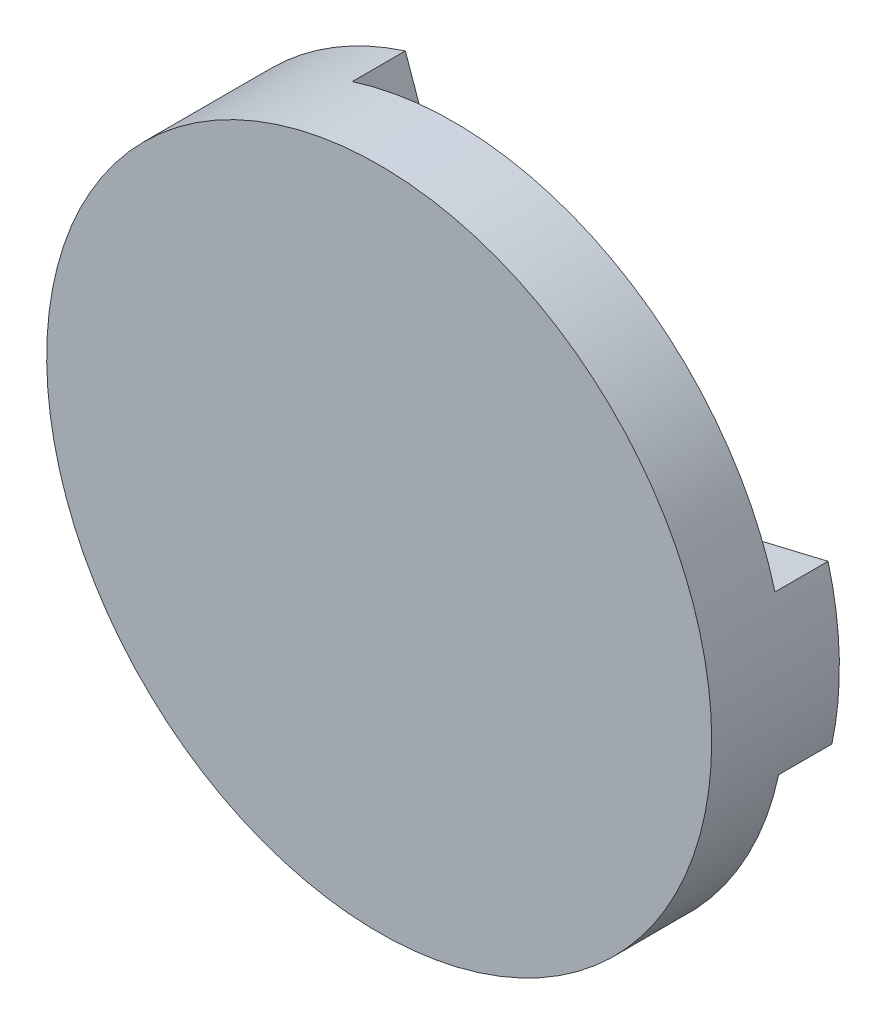
from build123d import *

# Parameters (mm, degrees)
BOSS_EXTRUDE1_DEPTH   = 12.7
BOSS_EXTRUDE1_2_DEPTH = 12.7
BOSS_EXTRUDE1_3_DEPTH = 12.7
SKETCH3_R             = 35.68082971
BOSS_EXTRUDE2_DEPTH   = 1
CUT_EXTRUDE1_DEPTH    = 3
BOSS_EXTRUDE3_START   = 7
BOSS_EXTRUDE3_DEPTH   = 7


with BuildPart() as part:
    # Sketch2 → Boss-Extrude1 (new body)
    with BuildSketch(Plane.XY):
        with BuildLine():
            Line((-39.100035207, -47.596183278), (-14.633983159, -52.182948751))
            ThreePointArc((-14.633983159, -52.182948751), (-13.835344136, -43.767548454), (-15.038788838, -35.400439796))
            Line((-15.038788838, -35.400439796), (-39.255245143, -41.161460912))
            ThreePointArc((-39.255245143, -41.161460912), (-38.688115422, -44.36701442), (-39.100035207, -47.596183278))
        make_face()
    extrude(amount=BOSS_EXTRUDE1_DEPTH)



with BuildPart() as body_2:
    # Sketch2 → Boss-Extrude1 2 (new body)
    with BuildSketch(Plane.XY):
        with BuildLine():
            Line((-52.138110144, -34.132169435), (-60.398880747, -10.650564096))
            ThreePointArc((-60.398880747, -10.650564096), (-68.086150698, -14.166622561), (-74.730557001, -19.392390574))
            Line((-74.730557001, -19.392390574), (-57.633138211, -37.483946366))
            ThreePointArc((-57.633138211, -37.483946366), (-55.1406123, -35.390020866), (-52.138110144, -34.132169435))
        make_face()
    extrude(amount=BOSS_EXTRUDE1_2_DEPTH)


with BuildPart() as body_3:
    # Sketch2 → Boss-Extrude1 3 (new body)
    with BuildSketch(Plane.XY):
        with BuildLine():
            Line((-58.748050211, -79.091002811), (-51.629012696, -55.238425903))
            ThreePointArc((-51.629012696, -55.238425903), (-54.688668329, -54.126797895), (-57.2792507, -52.155480469))
            Line((-57.2792507, -52.155480469), (-73.484532144, -71.050320335))
            ThreePointArc((-73.484532144, -71.050320335), (-66.595901216, -75.949662166), (-58.748050211, -79.091002811))
        make_face()
    extrude(amount=BOSS_EXTRUDE1_3_DEPTH)


with BuildPart() as part_1:
    add(part.part)

    add(body_2.part)  # Boss-Extrude2 merges body 2
    # Sketch3 → Boss-Extrude2 (add)
    with BuildSketch(Plane.XY.offset(12.7)):
        with Locations(Location((-49.505798683, -44.627944394, 0), (0, 0, 134.987742115))):
            Circle(SKETCH3_R)
    extrude(amount=BOSS_EXTRUDE2_DEPTH)


with BuildPart() as cut_extrude1_tool:
    # Sketch4 → Cut-Extrude1 (new body)
    with BuildSketch(Plane(origin=(0, 0, 0), x_dir=(-1, 0, 0), z_dir=(0, 0, -1))):
        with BuildLine():
            Line((72.786303474, -71.004238215), (57.24818113, -52.887284523))
            ThreePointArc((57.24818113, -52.887284523), (54.928154107, -54.565713106), (52.261209215, -55.608331369))
            Line((52.261209215, -55.608331369), (59.087161374, -78.478915843))
            ThreePointArc((59.087161374, -78.478915843), (66.356415438, -75.510746955), (72.786303474, -71.004238215))
        make_face()
        with BuildLine():
            Line((38.618799354, -41.524006424), (15.39931612, -36.000162163))
            ThreePointArc((15.39931612, -36.000162163), (14.335198748, -43.779605292), (15.023005781, -51.601306045))
            Line((15.023005781, -51.601306045), (38.48180909, -47.203374214))
            ThreePointArc((38.48180909, -47.203374214), (38.18826081, -44.354957583), (38.618799354, -41.524006424))
        make_face()
        with BuildLine():
            Line((57.637387481, -36.751495388), (74.030918556, -19.404755176))
            ThreePointArc((74.030918556, -19.404755176), (67.825781865, -14.593480934), (60.708086795, -11.278288922))
            Line((60.708086795, -11.278288922), (52.78740583, -33.793174445))
            ThreePointArc((52.78740583, -33.793174445), (55.400981133, -34.963162493), (57.637387481, -36.751495388))
        make_face()
    extrude(amount=-CUT_EXTRUDE1_DEPTH)


with BuildPart() as part_2:
    add(part_1.part)

    # Cut-Extrude1: cut by cut_extrude1_tool
    add(cut_extrude1_tool.part, mode=Mode.SUBTRACT)



with BuildPart() as body_3_1:
    add(body_3.part)

    # Cut-Extrude1: cut by cut_extrude1_tool
    add(cut_extrude1_tool.part, mode=Mode.SUBTRACT)


with BuildPart() as part_3:
    add(part_2.part)

    add(body_3_1.part)  # Boss-Extrude3 merges body 3
    # Sketch5 → Boss-Extrude3 (add)
    with BuildSketch(Plane(origin=(0, 0, 12.7), x_dir=(-1, 0, 0), z_dir=(0, 0, -1)).offset(BOSS_EXTRUDE3_START)):
        with BuildLine():
            Line((73.484532144, -71.050320335), (73.148515106, -70.680060224))
            ThreePointArc((73.148515106, -70.680060224), (84.676398619, -45.476283496), (74.377079258, -19.746019596))
            Line((74.377079258, -19.746019596), (74.730557001, -19.392390574))
            ThreePointArc((74.730557001, -19.392390574), (85.176253231, -45.488340334), (73.484532144, -71.050320335))
        make_face()
        with BuildLine():
            Line((14.633983159, -52.182948751), (15.122646341, -52.077079515))
            ThreePointArc((15.122646341, -52.077079515), (31.185815502, -74.662407853), (58.618537366, -78.608067595))
            Line((58.618537366, -78.608067595), (58.748050211, -79.091002811))
            ThreePointArc((58.748050211, -79.091002811), (30.925446669, -75.089266226), (14.633983159, -52.182948751))
        make_face()
        with BuildLine():
            Line((15.521779426, -35.529745991), (15.038788838, -35.400439796))
            ThreePointArc((15.038788838, -35.400439796), (32.415696151, -13.306226622), (60.398880747, -10.650564096))
            Line((60.398880747, -10.650564096), (60.246234604, -11.126693443))
            ThreePointArc((60.246234604, -11.126693443), (32.655181929, -13.745141832), (15.521779426, -35.529745991))
        make_face()
    extrude(amount=-BOSS_EXTRUDE3_DEPTH)


solid = part_3.part
